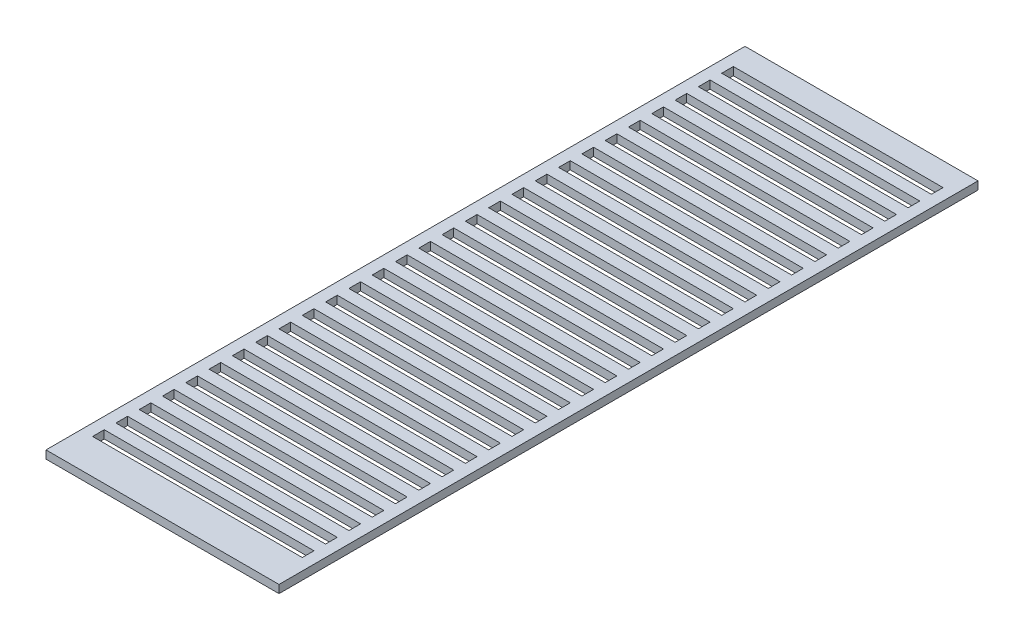
from build123d import *

# Parameters (mm, degrees)
SKETCH1_W           = 127
SKETCH1_H           = 381
SKETCH1_W_2         = 114.3
SKETCH1_H_2         = 6.35
BOSS_EXTRUDE1_DEPTH = 4.365625


with BuildPart() as part:
    # Sketch1 → Boss-Extrude1 (new body)
    with BuildSketch(Plane(origin=(0, 0, 0), x_dir=(1, 0, 0), z_dir=(0, 1, 0))):
        Rectangle(SKETCH1_W, SKETCH1_H)
        with Locations((0, 161.925)):
            Rectangle(SKETCH1_W_2, SKETCH1_H_2, mode=Mode.SUBTRACT)
        with Locations((0, 174.625)):
            Rectangle(SKETCH1_W_2, SKETCH1_H_2, mode=Mode.SUBTRACT)
        with Locations((0, 149.225)):
            Rectangle(SKETCH1_W_2, SKETCH1_H_2, mode=Mode.SUBTRACT)
        with Locations((0, 136.525)):
            Rectangle(SKETCH1_W_2, SKETCH1_H_2, mode=Mode.SUBTRACT)
        with Locations((0, 123.825)):
            Rectangle(SKETCH1_W_2, SKETCH1_H_2, mode=Mode.SUBTRACT)
        with Locations((0, 111.125)):
            Rectangle(SKETCH1_W_2, SKETCH1_H_2, mode=Mode.SUBTRACT)
        with Locations((0, 98.425)):
            Rectangle(SKETCH1_W_2, SKETCH1_H_2, mode=Mode.SUBTRACT)
        with Locations((0, 85.725)):
            Rectangle(SKETCH1_W_2, SKETCH1_H_2, mode=Mode.SUBTRACT)
        with Locations((0, 73.025)):
            Rectangle(SKETCH1_W_2, SKETCH1_H_2, mode=Mode.SUBTRACT)
        with Locations((0, 60.325)):
            Rectangle(SKETCH1_W_2, SKETCH1_H_2, mode=Mode.SUBTRACT)
        with Locations((0, 47.625)):
            Rectangle(SKETCH1_W_2, SKETCH1_H_2, mode=Mode.SUBTRACT)
        with Locations((0, 34.925)):
            Rectangle(SKETCH1_W_2, SKETCH1_H_2, mode=Mode.SUBTRACT)
        with Locations((0, 22.225)):
            Rectangle(SKETCH1_W_2, SKETCH1_H_2, mode=Mode.SUBTRACT)
        with Locations((0, 9.525)):
            Rectangle(SKETCH1_W_2, SKETCH1_H_2, mode=Mode.SUBTRACT)
        with Locations((0, -3.175)):
            Rectangle(SKETCH1_W_2, SKETCH1_H_2, mode=Mode.SUBTRACT)
        with Locations((0, -15.875)):
            Rectangle(SKETCH1_W_2, SKETCH1_H_2, mode=Mode.SUBTRACT)
        with Locations((0, -28.575)):
            Rectangle(SKETCH1_W_2, SKETCH1_H_2, mode=Mode.SUBTRACT)
        with Locations((0, -41.275)):
            Rectangle(SKETCH1_W_2, SKETCH1_H_2, mode=Mode.SUBTRACT)
        with Locations((0, -53.975)):
            Rectangle(SKETCH1_W_2, SKETCH1_H_2, mode=Mode.SUBTRACT)
        with Locations((0, -66.675)):
            Rectangle(SKETCH1_W_2, SKETCH1_H_2, mode=Mode.SUBTRACT)
        with Locations((0, -79.375)):
            Rectangle(SKETCH1_W_2, SKETCH1_H_2, mode=Mode.SUBTRACT)
        with Locations((0, -92.075)):
            Rectangle(SKETCH1_W_2, SKETCH1_H_2, mode=Mode.SUBTRACT)
        with Locations((0, -104.775)):
            Rectangle(SKETCH1_W_2, SKETCH1_H_2, mode=Mode.SUBTRACT)
        with Locations((0, -117.475)):
            Rectangle(SKETCH1_W_2, SKETCH1_H_2, mode=Mode.SUBTRACT)
        with Locations((0, -130.175)):
            Rectangle(SKETCH1_W_2, SKETCH1_H_2, mode=Mode.SUBTRACT)
        with Locations((0, -142.875)):
            Rectangle(SKETCH1_W_2, SKETCH1_H_2, mode=Mode.SUBTRACT)
        with Locations((0, -155.575)):
            Rectangle(SKETCH1_W_2, SKETCH1_H_2, mode=Mode.SUBTRACT)
        with Locations((0, -168.275)):
            Rectangle(SKETCH1_W_2, SKETCH1_H_2, mode=Mode.SUBTRACT)
    extrude(amount=BOSS_EXTRUDE1_DEPTH)


solid = part.part
